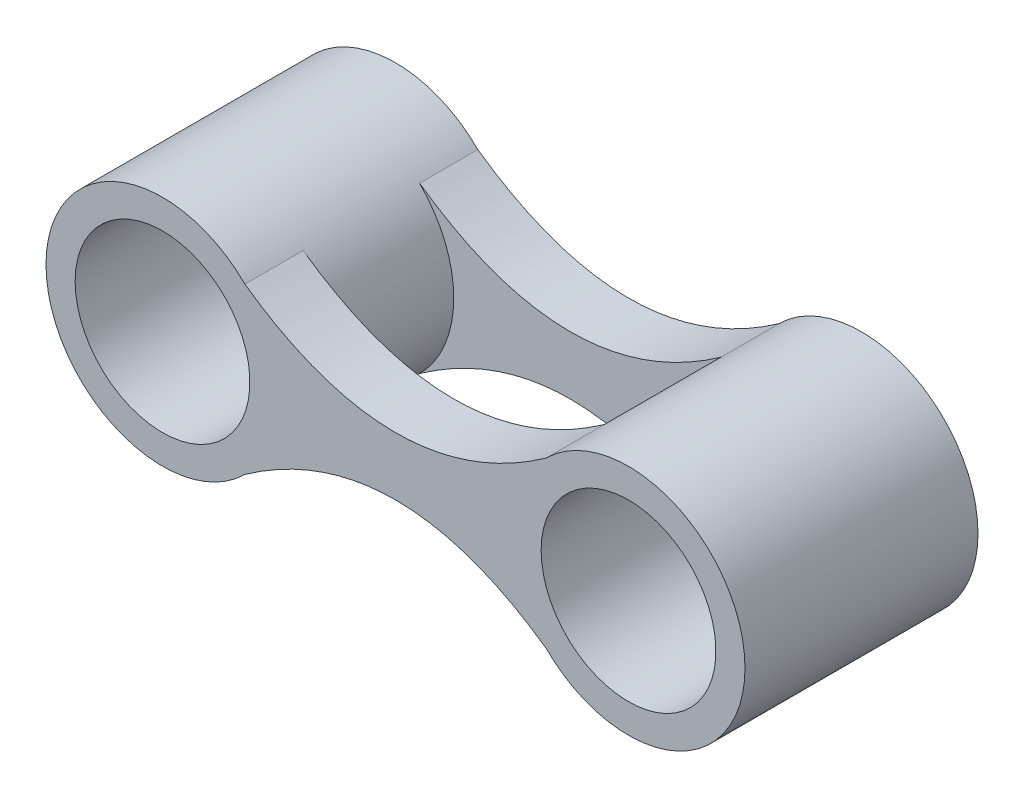
from build123d import *

# Parameters (mm, degrees)
BOSS_EXTRUDE1_DEPTH = 1.5875
SKETCH2_R           = 3.175
BOSS_EXTRUDE2_DEPTH = 3.175
SKETCH3_R           = 2.38125
CUT_EXTRUDE1_DEPTH  = 6.35
SCALE1_SCALE        = 0.75


with BuildPart() as part:
    # Sketch1 → Boss-Extrude1 (new body)
    with BuildSketch(Plane.XY):
        with BuildLine():
            ThreePointArc((-4.10493597, 2.24506403), (-9.525, 0), (-4.10493597, -2.24506403))
            add(Edge.make_bspline(
                [(-4.10493597, -2.24506403), (0, 0.65756403), (4.10493597, -2.24506403)],
                knots=[0, 0, 0, 1, 1, 1], degree=2))
            ThreePointArc((4.10493597, -2.24506403), (9.525, 0), (4.10493597, 2.24506403))
            add(Edge.make_bspline(
                [(-4.10493597, 2.24506403), (0, -0.65756403), (4.10493597, 2.24506403)],
                knots=[0, 0, 0, 1, 1, 1], degree=2))
        make_face()
    boss_extrude1 = extrude(amount=BOSS_EXTRUDE1_DEPTH)

    # Sketch2 → Boss-Extrude2 (add)
    with BuildSketch(Plane.XY.offset(1.5875)):
        with Locations(Location((-6.35, 0, 0), (0, 0, 315))):
            Circle(SKETCH2_R)
        with Locations(Location((6.35, 0, 0), (0, 0, 135))):
            Circle(SKETCH2_R)
    extrude(amount=BOSS_EXTRUDE2_DEPTH)

    # Mirror1: Boss-Extrude1 across plane
    add(boss_extrude1.mirror(Plane.XY.offset(3.175)))

    # Sketch3 → Cut-Extrude1 (cut)
    with BuildSketch(Plane(origin=(0, 0, 0), x_dir=(-1, 0, 0), z_dir=(0, 0, -1))):
        with Locations((-6.35, 0)):
            Circle(SKETCH3_R)
        with Locations((6.35, 0)):
            Circle(SKETCH3_R)
    extrude(amount=-CUT_EXTRUDE1_DEPTH, mode=Mode.SUBTRACT)


with BuildPart() as part_1:
    # Scale1: scaled about (0, 0, 3.175)
    add(part.part.scale(SCALE1_SCALE).moved(Location((0, 0, 0.79375))))


solid = part_1.part
